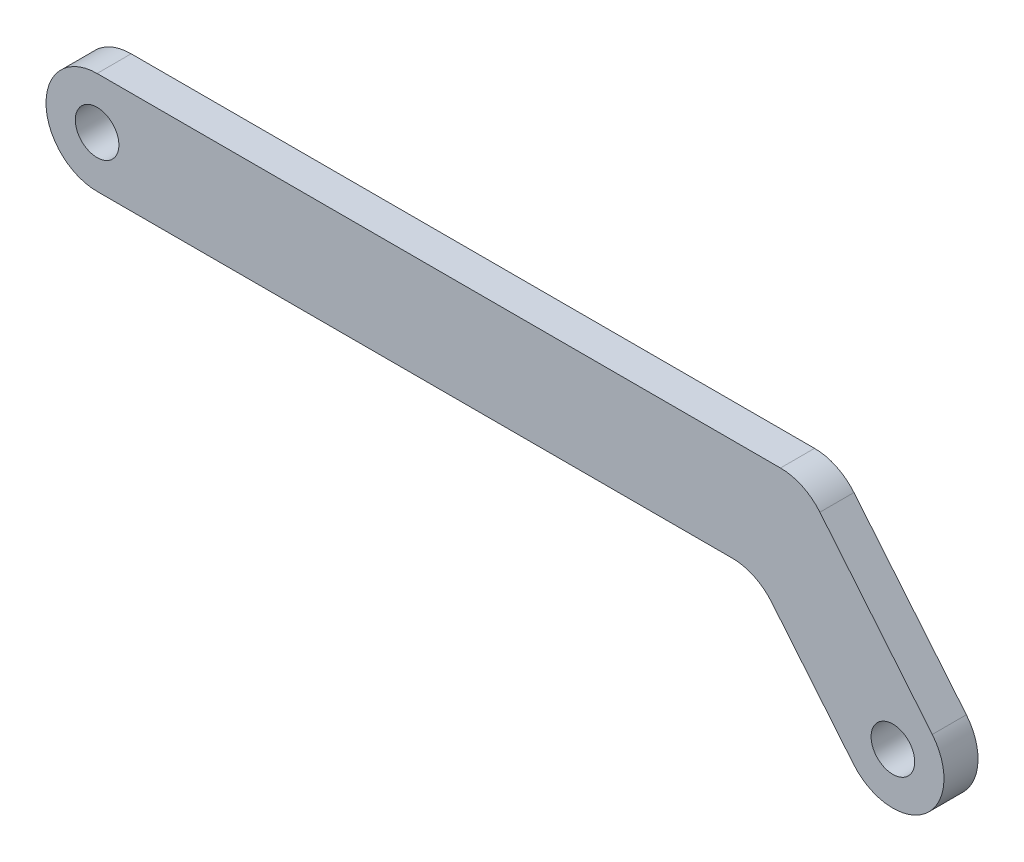
from build123d import *

# Parameters (mm, degrees)
SKETCH1_R           = 2.032
BOSS_EXTRUDE1_DEPTH = 3.175


with BuildPart() as part:
    # Sketch1 → Boss-Extrude1 (new body)
    with BuildSketch(Plane.XY):
        with BuildLine():
            Line((-74.177200143, 17.4625), (-10.4775, 17.4625))
            ThreePointArc((-10.4775, 17.4625), (-8.44681712, 17.007868764), (-6.803834761, 15.730773822))
            Line((-6.803834761, 15.730773822), (3.673665239, 3.030773822))
            ThreePointArc((3.673665239, 3.030773822), (3.030773822, -3.673665239), (-3.673665239, -3.030773822))
            Line((-3.673665239, -3.030773822), (-11.293817046, 6.205773822))
            ThreePointArc((-11.293817046, 6.205773822), (-12.936799404, 7.482868764), (-14.967482285, 7.9375))
            Line((-14.967482285, 7.9375), (-74.177200143, 7.9375))
            ThreePointArc((-74.177200143, 7.9375), (-78.939700143, 12.7), (-74.177200143, 17.4625))
        make_face()
        Circle(SKETCH1_R, mode=Mode.SUBTRACT)
        with Locations((-74.177200143, 12.7)):
            Circle(SKETCH1_R, mode=Mode.SUBTRACT)
    extrude(amount=BOSS_EXTRUDE1_DEPTH)


solid = part.part
